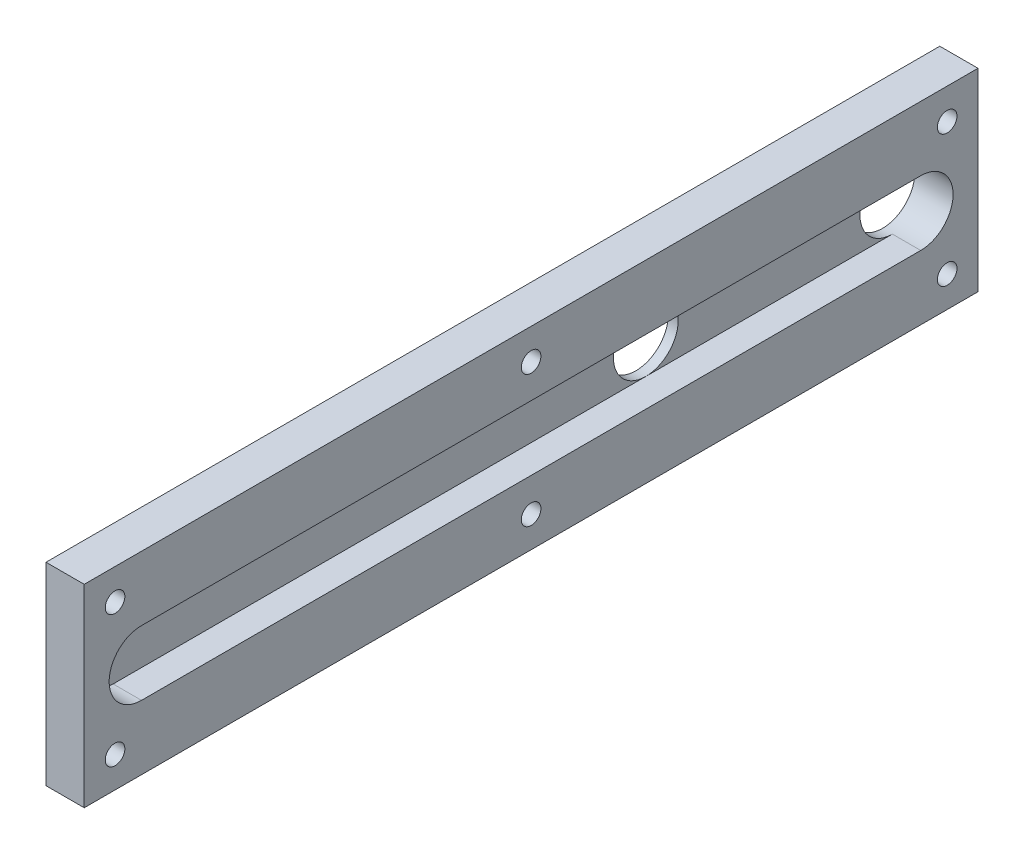
from build123d import *

# Parameters (mm, degrees)
SKETCH1_W              = 184.15
SKETCH1_H              = 39.878
BOSS_EXTRUDE1_DEPTH    = 7.874
F_10_32_TAPPED_HOLE1_D = 4.0386
BOSS_EXTRUDE2_DEPTH    = 2.032


with BuildPart() as part:
    # Sketch1 → Boss-Extrude1 (new body)
    with BuildSketch(Plane(origin=(0, 0, 0), x_dir=(0, 0, -1), z_dir=(1, 0, 0))):
        Rectangle(SKETCH1_W, SKETCH1_H)
        with BuildLine():
            Line((-80.27524839, 6.6675), (80.27524839, 6.6675))
            ThreePointArc((80.27524839, 6.6675), (86.94274839, 0), (80.27524839, -6.6675))
            Line((80.27524839, -6.6675), (-80.27524839, -6.6675))
            ThreePointArc((-80.27524839, -6.6675), (-86.94274839, 0), (-80.27524839, 6.6675))
        make_face(mode=Mode.SUBTRACT)
    extrude(amount=BOSS_EXTRUDE1_DEPTH)

    # #10-32 Tapped Hole1 (through all)
    with Locations(Plane(origin=(7.874, 0, 0), x_dir=(0, 0, -1), z_dir=(1, 0, 0))):
        with Locations((-85.725, 13.589), (-85.725, -13.589), (0, -13.589), (85.725, -13.589), (85.725, 13.589), (0, 13.589)):
            Hole(F_10_32_TAPPED_HOLE1_D / 2)

    # Sketch5 → Boss-Extrude2 (add)
    with BuildSketch(Plane.ZY):
        with BuildLine():
            ThreePointArc((-80.27524839, 6.6675), (-73.60774839, 0), (-80.27524839, -6.6675))
            Line((-80.27524839, -6.6675), (-29.47524839, -6.6675))
            ThreePointArc((-29.47524839, -6.6675), (-36.14274839, -3e-09), (-29.475248395, 6.6675))
            Line((-29.475248395, 6.6675), (-80.27524839, 6.6675))
        make_face()
        with BuildLine():
            ThreePointArc((-22.80774839, 0), (-24.760613926, -4.714634464), (-29.47524839, -6.6675))
            Line((-29.47524839, -6.6675), (80.27524839, -6.6675))
            ThreePointArc((80.27524839, -6.6675), (86.94274839, 0), (80.27524839, 6.6675))
            Line((80.27524839, 6.6675), (-29.475248395, 6.6675))
            ThreePointArc((-29.475248395, 6.6675), (-24.760613928, 4.714634465), (-22.80774839, 0))
        make_face()
    extrude(amount=-BOSS_EXTRUDE2_DEPTH)


solid = part.part
